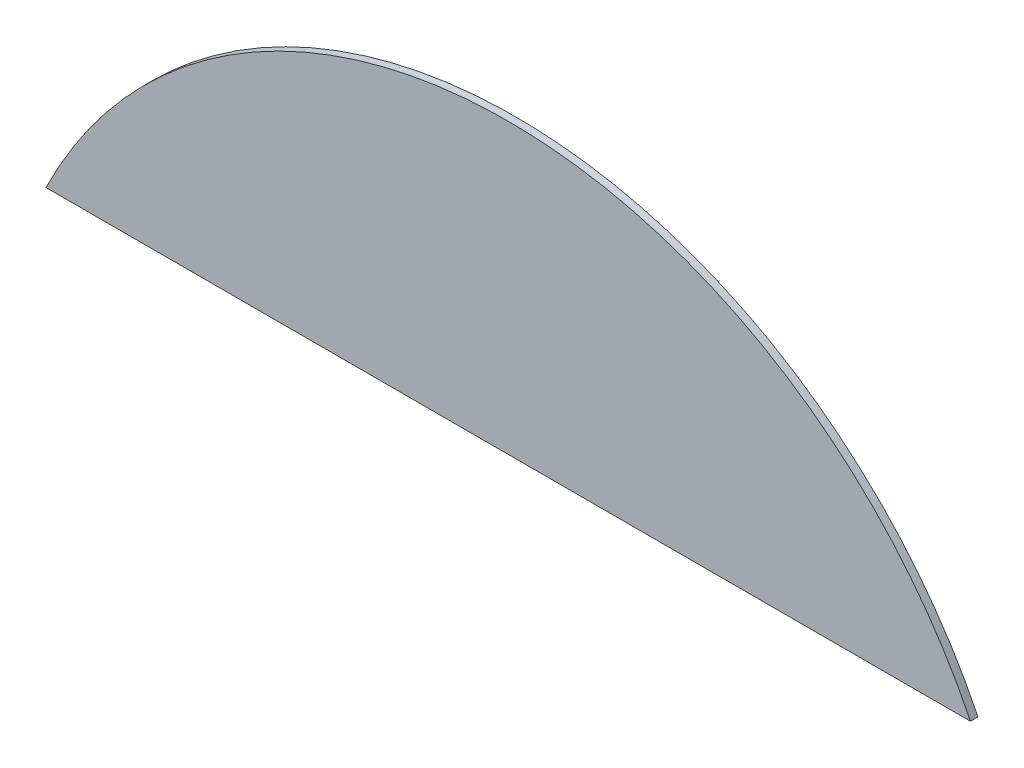
from build123d import *
from build123d.topology import SkipClean

# Parameters (mm, degrees)
SKETCH_1_R          = 210
SKETCH_1_R_2        = 203
EXTRUDE_2_DEPTH     = 174
EXTRUDE_START       = -174
EXTRUDE_4_DEPTH     = 174
CUT_EXTRUDE_1_DEPTH = 654
EXTRUDE_5_DEPTH     = 174
EXTRUDE_6_DEPTH     = 174
EXTRUDE_7_DEPTH     = 174
EXTRUDE_8_DEPTH     = 174
CUT_EXTRUDE_START   = -654
CUT_EXTRUDE_2_DEPTH = 654
SKETCH_10_W         = 20.487801248
SKETCH_10_H         = 174
CUT_EXTRUDE_3_DEPTH = 327
SKETCH_11_W         = 235.63772895
SKETCH_11_H         = 249.192111589
CUT_EXTRUDE_4_DEPTH = 238
EXTRUDE_10_DEPTH    = 180
SKETCH_17_W         = 286.098661696
SKETCH_17_H         = 191.878669743
CUT_EXTRUDE_5_DEPTH = 322
EXTRUDE_11_DEPTH    = 180
SKETCH_20_R         = 4
CUT_EXTRUDE_7_DEPTH = 555.5
EXTRUDE_13_DEPTH    = 3
SKETCH_25_W         = 733.806449845
SKETCH_25_H         = 306.921913774
CUT_EXTRUDE_8_DEPTH = 240.5


with BuildPart() as part:
    # 草图1 → 凸台-拉伸2 (new body)
    with BuildSketch(Plane.XY):
        Circle(SKETCH_1_R)
        Circle(SKETCH_1_R_2, mode=Mode.SUBTRACT)
    extrude(amount=EXTRUDE_2_DEPTH)

    # 草图2 → 凸台-拉伸4 (add)
    with BuildSketch(Plane.XY.offset(174).offset(EXTRUDE_START)):
        with BuildLine():
            Line((-170.735431044, -102), (-173.735431044, -102))
            Line((-173.735431044, -102), (-175.513532242, -102))
            ThreePointArc((-175.513532242, -102), (-174.63092392, -103.50381834), (-173.735431044, -105))
            Line((-173.735431044, -105), (-170.735431044, -105))
            Line((-170.735431044, -105), (-170.735431044, -102))
        make_face()
        with BuildLine():
            ThreePointArc((173.735431044, -105), (174.63092392, -103.50381834), (175.513532242, -102))
            Line((175.513532242, -102), (173.735431044, -102))
            Line((173.735431044, -102), (170.735431044, -102))
            Line((170.735431044, -102), (170.735431044, -105))
            Line((170.735431044, -105), (173.735431044, -105))
        make_face()
    extrude(amount=EXTRUDE_4_DEPTH)

    # 草图3 → 切除-拉伸1 (cut)
    with BuildSketch(Plane.XY.offset(174)):
        Polygon((-170.735431044, -102), (238.333646515, -102), (254.334169784, 272.292523591), (-334.569415043, 221.85110305), (-306.830562533, -102), align=None)
    extrude(amount=-CUT_EXTRUDE_1_DEPTH, mode=Mode.SUBTRACT)

    # 草图5 → 凸台-拉伸5 (add)
    with BuildSketch(Plane.XY.offset(174).offset(EXTRUDE_START)):
        with BuildLine():
            Line((-120, -209.75), (-10.243900624, -209.75))
            ThreePointArc((-10.243900624, -209.75), (-67.755470707, -198.769203322), (-120, -172.336879396))
            Line((-120, -172.336879396), (-120, -209.75))
        make_face()
        with BuildLine():
            ThreePointArc((120, -172.336879396), (67.755470707, -198.769203322), (10.243900624, -209.75))
            Line((10.243900624, -209.75), (120, -209.75))
            Line((120, -209.75), (120, -172.336879396))
        make_face()
    extrude(amount=EXTRUDE_5_DEPTH)

    # 草图6 → 凸台-拉伸6 (add)
    with BuildSketch(Plane.XY.offset(174).offset(EXTRUDE_START)):
        with BuildLine():
            Line((-175.513532242, -102), (-166.195667814, -102))
            ThreePointArc((-166.195667814, -102), (0, -195), (166.195667814, -102))
            Line((166.195667814, -102), (175.513532242, -102))
            ThreePointArc((175.513532242, -102), (0, -203), (-175.513532242, -102))
        make_face()
    extrude(amount=EXTRUDE_6_DEPTH)

    # 草图7 → 凸台-拉伸7 (add)
    with BuildSketch(Plane.XY.offset(174).offset(EXTRUDE_START)):
        with BuildLine():
            Line((-166.933126535, -92), (-166.933126535, -95))
            Line((-166.933126535, -95), (-170.293863659, -95))
            ThreePointArc((-170.293863659, -95), (0, -195), (170.293863659, -95))
            Line((170.293863659, -95), (166.933126535, -95))
            Line((166.933126535, -95), (166.933126535, -92))
            Line((166.933126535, -92), (171.933126535, -92))
            Line((171.933126535, -92), (188.496850106, -92))
            ThreePointArc((188.496850106, -92), (0, -209.75), (-188.496850106, -92))
            Line((-188.496850106, -92), (-171.933126535, -92))
            Line((-171.933126535, -92), (-166.933126535, -92))
        make_face()
    extrude(amount=EXTRUDE_7_DEPTH)

    # 草图8 → 凸台-拉伸8 (add)
    with BuildSketch(Plane(origin=(0, 0, 0), x_dir=(-1, 0, 0), z_dir=(0, 0, -1))):
        with BuildLine():
            Line((166.933126535, -92), (163.933126535, -92))
            Line((163.933126535, -92), (163.933126535, -99))
            Line((163.933126535, -99), (168, -99))
            ThreePointArc((168, -99), (169.158755456, -97.006780447), (170.293863659, -95))
            Line((170.293863659, -95), (166.933126535, -95))
            Line((166.933126535, -95), (166.933126535, -92))
        make_face()
        with BuildLine():
            Line((-166.933126535, -95), (-170.293863659, -95))
            ThreePointArc((-170.293863659, -95), (-169.158755456, -97.006780447), (-168, -99))
            Line((-168, -99), (-163.933126535, -99))
            Line((-163.933126535, -99), (-163.933126535, -92))
            Line((-163.933126535, -92), (-166.933126535, -92))
            Line((-166.933126535, -92), (-166.933126535, -95))
        make_face()
    extrude(amount=-EXTRUDE_8_DEPTH)

    # 草图9 → 切除-拉伸2 (cut)
    with BuildSketch(Plane.XY.offset(174).offset(CUT_EXTRUDE_START)):
        with BuildLine():
            Line((0, -195), (0, -182.225251044))
            Line((0, -182.225251044), (-50, -182.225251044))
            Line((-50, -182.225251044), (-50, -188.48076825))
            ThreePointArc((-50, -188.48076825), (-25.211606368, -193.363323576), (0, -195))
        make_face()
        with BuildLine():
            Line((0, -209.75), (0, -195))
            ThreePointArc((0, -195), (-25.211606368, -193.363323576), (-50, -188.48076825))
            Line((-50, -188.48076825), (-50, -195))
            Line((-50, -195), (-50, -209.75))
            Line((-50, -209.75), (-10.243900624, -209.75))
            Line((-10.243900624, -209.75), (0, -209.75))
        make_face()
        with BuildLine():
            ThreePointArc((50, -188.48076825), (25.211606368, -193.363323576), (0, -195))
            Line((0, -195), (0, -209.75))
            Line((0, -209.75), (10.243900624, -209.75))
            Line((10.243900624, -209.75), (50, -209.75))
            Line((50, -209.75), (50, -195))
            Line((50, -195), (50, -188.48076825))
        make_face()
        with BuildLine():
            Line((50, -182.225251044), (0, -182.225251044))
            Line((0, -182.225251044), (0, -195))
            ThreePointArc((0, -195), (25.211606368, -193.363323576), (50, -188.48076825))
            Line((50, -188.48076825), (50, -182.225251044))
        make_face()
    extrude(amount=CUT_EXTRUDE_2_DEPTH, mode=Mode.SUBTRACT)


with BuildPart() as cut_extrude_2_piece_1:
    # of the separate pieces the step leaves, piece 1, a body of its own (cut_extrude_2_pieces)
    add(part.part.solids().sort_by_distance((-183.564702489, -102, 0))[0])

    # 草图11 → 切除-拉伸4 (cut)
    with BuildSketch(Plane(origin=(0, 0, 0), x_dir=(-1, 0, 0), z_dir=(0, 0, -1))):
        with Locations((136.586471206, -141.23053543)):
            Rectangle(SKETCH_11_W, SKETCH_11_H)
    extrude(amount=-CUT_EXTRUDE_4_DEPTH, mode=Mode.SUBTRACT)


with BuildPart() as cut_extrude_2_piece_2:
    # of the separate pieces the step leaves, piece 2, a body of its own (cut_extrude_2_pieces)
    add(part.part.solids().sort_by_distance((50, -188.48076825, 0))[0])

    # 草图17 → 切除-拉伸5 (cut)
    with BuildSketch(Plane(origin=(0, -92, 0), x_dir=(1, 0, 0), z_dir=(0, 1, 0))):
        with Locations((123.864076708, -90.777636372)):
            Rectangle(SKETCH_17_W, SKETCH_17_H)
    extrude(amount=-CUT_EXTRUDE_5_DEPTH, mode=Mode.SUBTRACT)


with BuildPart() as cut_extrude_2_piece_3:
    # of the separate pieces the step leaves, piece 3, a body of its own (cut_extrude_2_pieces)
    add(part.part.solids().sort_by_distance((10.243900624, -209.75, 0))[0])

    # 草图10 → 切除-拉伸3 (cut, symmetric)
    with BuildSketch(Plane(origin=(0, -209.75, 0), x_dir=(1, 0, 0), z_dir=(0, 1, 0))):
        with Locations((0, -87)):
            Rectangle(SKETCH_10_W, SKETCH_10_H)
    extrude(amount=CUT_EXTRUDE_3_DEPTH, both=True, mode=Mode.SUBTRACT)


with BuildPart() as body_2:
    # 草图14 → 凸台-拉伸10 (new body)
    with BuildSketch(Plane.XY.offset(209.75)):
        with BuildLine():
            Line((0, 210), (0, 205))
            ThreePointArc((0, 205), (174.477792283, 107.622023768), (183.196615689, -92))
            Line((183.196615689, -92), (188.774998345, -92))
            ThreePointArc((188.774998345, -92), (178.073018731, 111.310376875), (0, 210))
        make_face()
    extrude(amount=EXTRUDE_10_DEPTH)

    # 草图18 → 凸台-拉伸11 (add)
    with SkipClean():  # the faces are left unmerged after this step: merging them gives an invalid solid
        with BuildSketch(Plane.XY.offset(389.75)):
            with BuildLine():
                ThreePointArc((0, 210), (-178.073018731, 111.310376875), (-188.774998345, -92))
                Line((-188.774998345, -92), (-183.196615689, -92))
                ThreePointArc((-183.196615689, -92), (-174.477792283, 107.622023768), (0, 205))
                Line((0, 205), (0, 210))
            make_face()
        extrude(amount=-EXTRUDE_11_DEPTH)

    # 草图20 → 切除-拉伸7 (cut, symmetric)
    with SkipClean():  # the faces are left unmerged after this step: merging them gives an invalid solid
        with BuildSketch(Plane(origin=(0, 0, 0), x_dir=(0, 0, -1), z_dir=(1, 0, 0))):
            with Locations((-382.75, 98)):
                Circle(SKETCH_20_R)
        extrude(amount=CUT_EXTRUDE_7_DEPTH, both=True, mode=Mode.SUBTRACT)

    # 草图25 → 切除-拉伸8 (cut, symmetric)
    with BuildSketch(Plane(origin=(0, 0, 0), x_dir=(1, 0, 0), z_dir=(0, 1, 0))):
        with Locations((28.762967919, -312.90839884)):
            Rectangle(SKETCH_25_W, SKETCH_25_H)
    extrude(amount=CUT_EXTRUDE_8_DEPTH, both=True, mode=Mode.SUBTRACT)


with BuildPart() as body_2_2:
    # 草图24 → 凸台-拉伸13 (new body)
    with BuildSketch(Plane.XY):
        with BuildLine():
            Line((-184.187404564, 90), (0, 90))
            Line((0, 90), (184.187404564, 90))
            ThreePointArc((184.187404564, 90), (181.243442773, 95.790471613), (178.117498021, 101.484761905))
            ThreePointArc((178.117498021, 101.484761905), (0, 205), (-178.117498021, 101.484761905))
            ThreePointArc((-178.117498021, 101.484761905), (-181.243442773, 95.790471613), (-184.187404564, 90))
        make_face()
    extrude(amount=EXTRUDE_13_DEPTH)


solid = body_2_2.part
